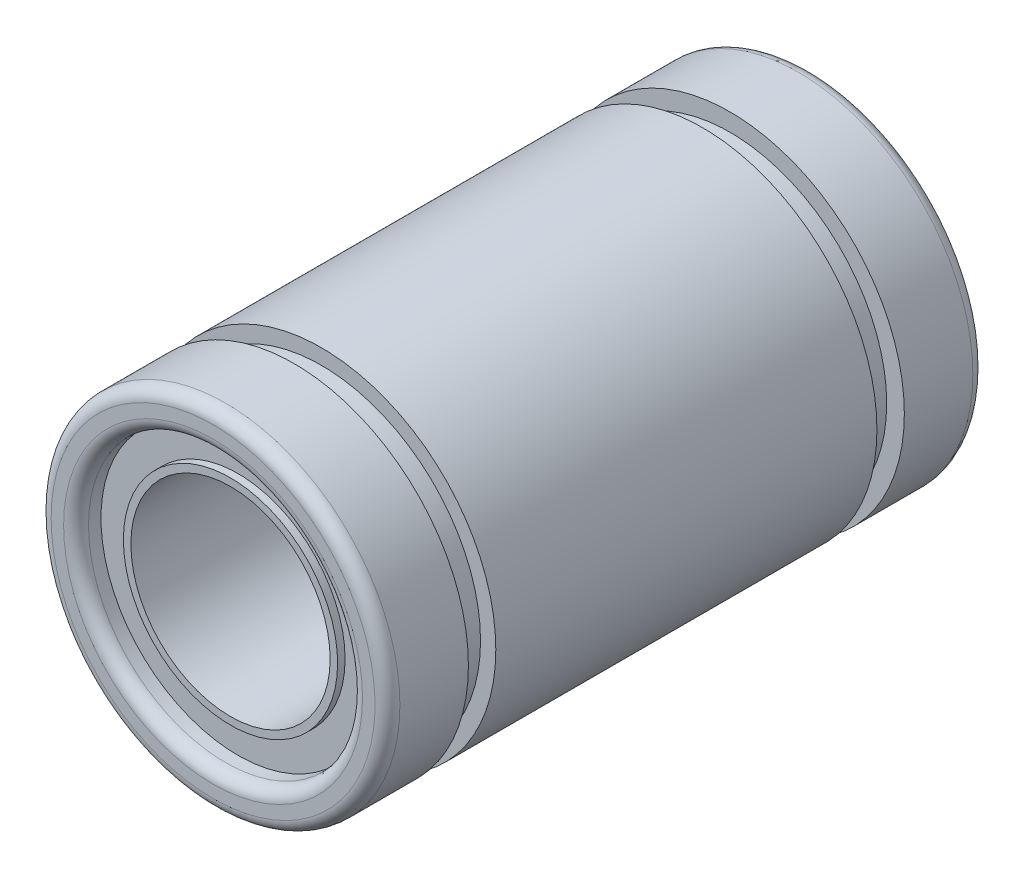
from build123d import *

# Parameters (mm, degrees)
FILLET1_R           = 0.5
SKETCH5_R           = 5.5
CUT_EXTRUDE1_DEPTH  = 1
FILLET2_R           = 0.5
CUT_EXTRUDE2_START  = -1
SKETCH6_R           = 5.5
CUT_EXTRUDE2_DEPTH  = 1
FILLET3_R           = 0.5
SKETCH8_R           = 4.3
SKETCH8_R_2         = 4
BOSS_EXTRUDE4_DEPTH = 0.3
BOSS_EXTRUDE5_START = 0.3
SKETCH9_R           = 4.3
SKETCH9_R_2         = 4
BOSS_EXTRUDE5_DEPTH = 0.3


with BuildPart() as part:
    # Sketch4 → Revolve1 (revolve)
    with BuildSketch(Plane(origin=(0, 0, 0), x_dir=(0, 0, -1), z_dir=(1, 0, 0)), mode=Mode.PRIVATE) as revolve1_sk:
        Polygon((-0.139006256, 4), (23.860993744, 4), (23.860993744, 7), (20.610993744, 7), (20.610993744, 6.291984931), (19.510993744, 6.291984931), (19.510993744, 7), (4.210993744, 7), (4.210993744, 6.386905477), (3.110993744, 6.386905477), (3.110993744, 7), (-0.139006256, 7), align=None)
    revolve(revolve1_sk.sketch.rotate(Axis((0, 0, 0), (0, 0, -1)), 90), axis=Axis((0, 0, 0), (0, 0, -1)))

    # Fillet1
    fillet1_edges = [part.edges().sort_by_distance(p)[0] for p in [
        (-7, 0, -23.860993744),
        (-7, 0, 0.139006256),
    ]]
    fillet(fillet1_edges, radius=FILLET1_R)

    # Sketch5 → Cut-Extrude1 (cut)
    with BuildSketch(Plane.XY.offset(0.139006256)):
        Circle(SKETCH5_R)
    extrude(amount=-CUT_EXTRUDE1_DEPTH, mode=Mode.SUBTRACT)

    # Fillet2
    fillet2_edges = [part.edges().sort_by_distance(p)[0] for p in [
        (-5.5, 0, 0.139006256),
    ]]
    fillet(fillet2_edges, radius=FILLET2_R)

    # Sketch6 → Cut-Extrude2 (cut)
    with BuildSketch(Plane(origin=(0, 0, -23.860993744), x_dir=(-1, 0, 0), z_dir=(0, 0, -1)).offset(CUT_EXTRUDE2_START)):
        with Locations(Location((0, 0, 0), (0, 0, 180))):
            Circle(SKETCH6_R)
    extrude(amount=CUT_EXTRUDE2_DEPTH, mode=Mode.SUBTRACT)

    # Fillet3
    fillet3_edges = [part.edges().sort_by_distance(p)[0] for p in [
        (-5.5, 0, -23.860993744),
    ]]
    fillet(fillet3_edges, radius=FILLET3_R)

    # Sketch8 → Boss-Extrude4 (add)
    with BuildSketch(Plane.XY.offset(-0.860993744)):
        Circle(SKETCH8_R)
        Circle(SKETCH8_R_2, mode=Mode.SUBTRACT)
    extrude(amount=BOSS_EXTRUDE4_DEPTH)

    # Sketch9 → Boss-Extrude5 (add)
    with BuildSketch(Plane(origin=(0, 0, -22.860993744), x_dir=(-1, 0, 0), z_dir=(0, 0, -1)).offset(BOSS_EXTRUDE5_START)):
        with Locations(Location((0, 0, 0), (0, 0, 180))):
            Circle(SKETCH9_R)
        with Locations(Location((0, 0, 0), (0, 0, 180))):
            Circle(SKETCH9_R_2, mode=Mode.SUBTRACT)
    extrude(amount=-BOSS_EXTRUDE5_DEPTH)


solid = part.part
